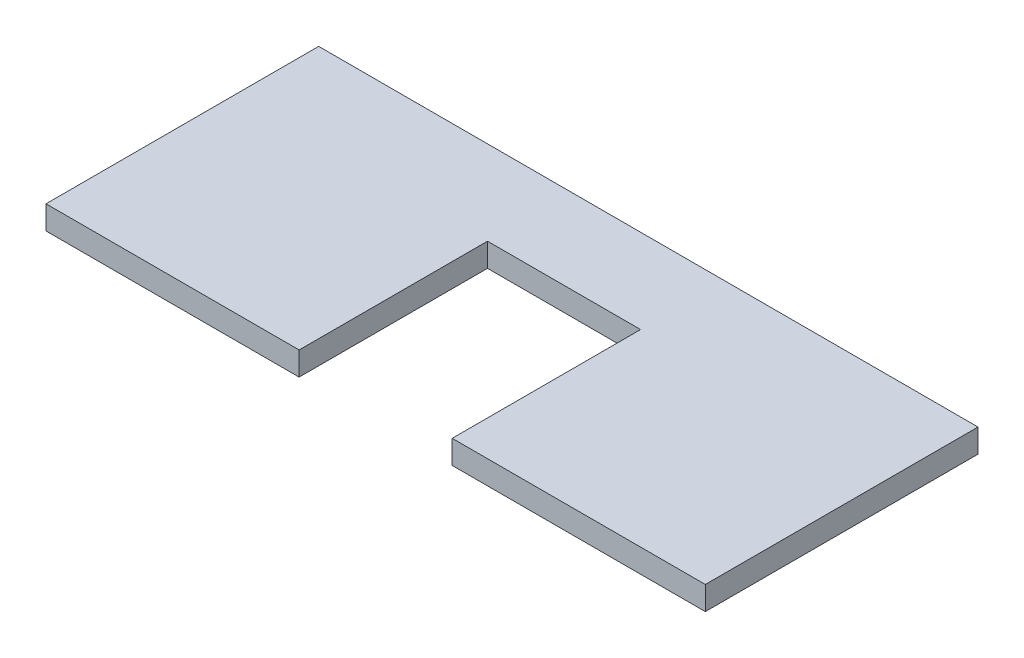
from build123d import *

# Parameters (mm, degrees)
BOSS_EXTRUDE1_DEPTH = 12.7


with BuildPart() as part:
    # Sketch1 → Boss-Extrude1 (new body)
    with BuildSketch(Plane(origin=(0, 0, 0), x_dir=(1, 0, 0), z_dir=(0, 1, 0))):
        Polygon((-41.275, -101.6), (-41.275, 0), (41.275, 0), (41.275, -101.6), (177.8, -101.6), (177.8, 45.466), (-177.8, 45.466), (-177.8, -101.6), align=None)
    extrude(amount=BOSS_EXTRUDE1_DEPTH)


solid = part.part
